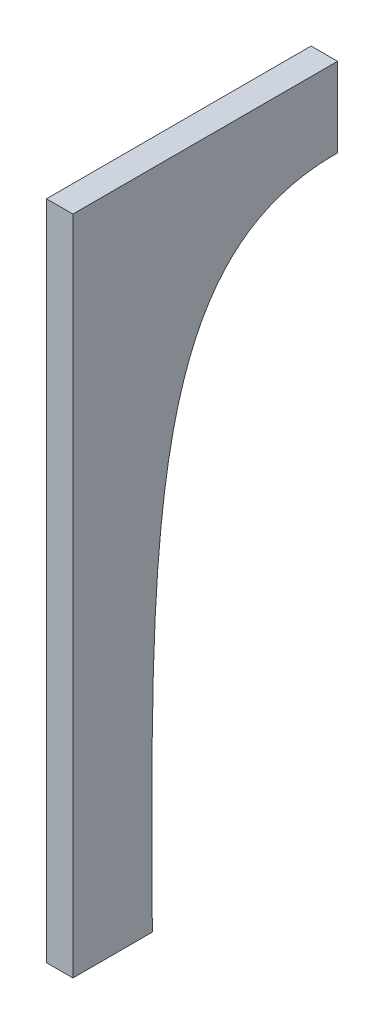
from build123d import *

# Parameters (mm, degrees)
BOSS_EXTRUDE1_DEPTH = 12.7


with BuildPart() as part:
    # Sketch1 → Boss-Extrude1 (new body)
    with BuildSketch(Plane(origin=(0, 0, 0), x_dir=(0, 0, -1), z_dir=(1, 0, 0))):
        with BuildLine():
            Line((0, 0), (0, 317.5))
            Line((0, 317.5), (127, 317.5))
            Line((127, 317.5), (127, 279.4))
            add(Edge.make_bspline(
                [(38.1, 0), (36.939409863, 172.867425699), (37.301191912, 280.238281825), (127, 279.4)],
                knots=[0, 0, 0, 0, 1, 1, 1, 1], degree=3))
            Line((38.1, 0), (0, 0))
        make_face()
    extrude(amount=BOSS_EXTRUDE1_DEPTH)


solid = part.part
